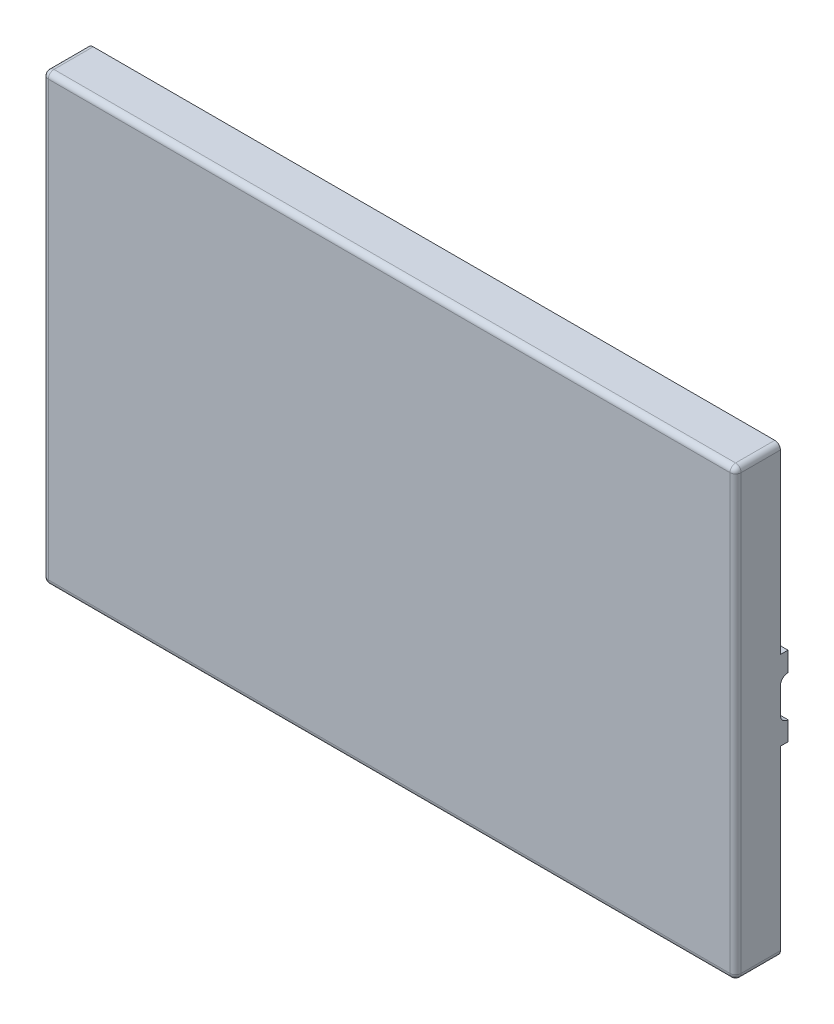
from build123d import *

# Parameters (mm, degrees)
SKETCH1_W                                = 157.01375
SKETCH1_H                                = 100.80625
BOSS_EXTRUDE1_DEPTH                      = 10.16
SKETCH2_W                                = 144.31375
SKETCH2_H                                = 88.10625
CUT_EXTRUDE1_DEPTH                       = 3.81
SKETCH3_R                                = 1.373000048
BOSS_EXTRUDE2_DEPTH                      = 13.208
SKETCH4_R                                = 1.905
SKETCH4_W                                = 38.820000042
SKETCH4_H                                = 30.86
BOSS_EXTRUDE3_DEPTH                      = 3.556
SKETCH5_W                                = 140.45073311
SKETCH5_H                                = 20.997286457
CUT_EXTRUDE2_DEPTH                       = 61.722
SKETCH6_W                                = 3.175
SKETCH6_H                                = 3.175
BOSS_EXTRUDE4_DEPTH                      = 6.985
SKETCH7_W                                = 1.5875
SKETCH7_H                                = 1.5875
CUT_EXTRUDE3_DEPTH                       = 6.985
MIRROR2_COPY_1_SKETCH_W                  = 3.175
MIRROR2_COPY_1_SKETCH_H                  = 3.175
MIRROR2_COPY_1_DEPTH                     = 6.985
MIRROR2_COPY_2_SKETCH_W                  = 1.5875
MIRROR2_COPY_2_SKETCH_H                  = 1.5875
MIRROR2_COPY_2_DEPTH                     = 6.985
CUT_EXTRUDE4_DEPTH                       = 3.175
MIRROR3_AT_THE_SECOND_PLANE_COPY_1_DEPTH = 3.175
FILLET1_R                                = 1.27
SKETCH9_W                                = 23.8125
SKETCH9_H                                = 15.875
BOSS_EXTRUDE5_DEPTH                      = 11.4935
CUT_EXTRUDE5_START                       = -1.5875
SKETCH10_W                               = 9.261227228
SKETCH10_H                               = 18.25625
CUT_EXTRUDE5_DEPTH                       = 13.97
SKETCH12_W                               = 17.78
SKETCH12_H                               = 18.25625
BOSS_EXTRUDE6_DEPTH                      = 3.01625
SKETCH13_W                               = 3.175
SKETCH13_H                               = 8.09625
BOSS_EXTRUDE7_DEPTH                      = 5.08
BOSS_EXTRUDE9_DEPTH                      = 1.5875
SKETCH17_W                               = 25.4
SKETCH17_H                               = 3.81
SKETCH17_W_2                             = 3.81
SKETCH17_H_2                             = 6.35
BOSS_EXTRUDE10_DEPTH                     = 5.36575
SKETCH18_W                               = 19.05
SKETCH18_H                               = 17.414875
SKETCH18_W_2                             = 6.35
BOSS_EXTRUDE11_DEPTH                     = 3.556
SKETCH19_W                               = 13.81125
SKETCH19_H                               = 4.34975
BOSS_EXTRUDE12_DEPTH                     = 6.35
SKETCH21_W                               = 5.794375
SKETCH21_H                               = 6.35
BOSS_EXTRUDE13_DEPTH                     = 10.4775
SKETCH22_W                               = 19.84375
SKETCH22_H                               = 0.79375
CUT_EXTRUDE6_DEPTH                       = 6.12775
SKETCH23_W                               = 1.905
SKETCH23_H                               = 6.35
SKETCH23_W_2                             = 25.4
SKETCH23_H_2                             = 1.905
CUT_EXTRUDE7_DEPTH                       = 5.36575


with BuildPart() as part:
    # Sketch1 → Boss-Extrude1 (new body)
    with BuildSketch(Plane.XY):
        with Locations((-142.135983, -138.289483)):
            Rectangle(SKETCH1_W, SKETCH1_H)
    extrude(amount=BOSS_EXTRUDE1_DEPTH)

    # Sketch2 → Cut-Extrude1 (cut)
    with BuildSketch(Plane(origin=(0, 0, 0), x_dir=(-1, 0, 0), z_dir=(0, 0, -1))):
        with Locations((142.135983, -138.289483)):
            Rectangle(SKETCH2_W, SKETCH2_H)
    extrude(amount=-CUT_EXTRUDE1_DEPTH, mode=Mode.SUBTRACT)

    # Sketch3 → Boss-Extrude2 (add)
    with BuildSketch(Plane(origin=(0, 0, 3.81), x_dir=(-1, 0, 0), z_dir=(0, 0, -1))):
        with Locations((109.299108, -111.990108)):
            Circle(SKETCH3_R)
        with Locations((156.249108, -111.990108)):
            Circle(SKETCH3_R)
        with Locations((156.249108, -136.500108)):
            Circle(SKETCH3_R)
        with Locations((109.299108, -136.500108)):
            Circle(SKETCH3_R)
    extrude(amount=BOSS_EXTRUDE2_DEPTH)

    # Sketch4 → Boss-Extrude3 (add)
    # profile 1 of 3: a face of its own
    with BuildSketch(Plane(origin=(0, 0, 3.81), x_dir=(-1, 0, 0), z_dir=(0, 0, -1))):
        with Locations(Location((109.299108, -111.990108, 0), (0, 0, 180))):
            Circle(SKETCH4_R)
    # profile 2 of 3: a face of its own
    with BuildSketch(Plane(origin=(0, 0, 3.81), x_dir=(-1, 0, 0), z_dir=(0, 0, -1))):
        with Locations(Location((109.299108, -136.500108, 0), (0, 0, 180))):
            Circle(SKETCH4_R)
    # profile 3 of 3: a face of its own
    with BuildSketch(Plane(origin=(0, 0, 3.81), x_dir=(-1, 0, 0), z_dir=(0, 0, -1))):
        Polygon((112.454108, -105.170108), (191.274108, -105.170108), (191.274108, -110.270108), (201.354108, -110.270108), (201.354108, -143.270108), (112.454108, -143.270108), align=None)
        with Locations((135.039108021, -124.245108)):
            Rectangle(SKETCH4_W, SKETCH4_H, mode=Mode.SUBTRACT)
    extrude(amount=BOSS_EXTRUDE3_DEPTH)

    # Sketch5 → Cut-Extrude2 (cut)
    with BuildSketch(Plane(origin=(0, -87.886358, 0), x_dir=(1, 0, 0), z_dir=(0, 1, 0))):
        with Locations((-140.972363451, 12.879893229)):
            Rectangle(SKETCH5_W, SKETCH5_H)
    extrude(amount=-CUT_EXTRUDE2_DEPTH, mode=Mode.SUBTRACT)

    # Sketch6 → Boss-Extrude4 (add)
    with BuildSketch(Plane(origin=(0, 0, 3.81), x_dir=(-1, 0, 0), z_dir=(0, 0, -1))):
        with Locations((71.566608, -180.755108)):
            Rectangle(SKETCH6_W, SKETCH6_H)
    boss_extrude4 = extrude(amount=BOSS_EXTRUDE4_DEPTH)

    # Sketch7 → Cut-Extrude3 (cut)
    with BuildSketch(Plane(origin=(0, 0, -3.175), x_dir=(-1, 0, 0), z_dir=(0, 0, -1))):
        with Locations((72.360358, -179.961358)):
            Rectangle(SKETCH7_W, SKETCH7_H)
    cut_extrude3 = extrude(amount=-CUT_EXTRUDE3_DEPTH, mode=Mode.SUBTRACT)

    # Mirror1: Boss-Extrude4, Cut-Extrude3 across plane
    add(boss_extrude4.mirror(Plane(origin=(0, -138.289483, 0), x_dir=(0, 0, 1), z_dir=(0, -1, 0))))
    add(cut_extrude3.mirror(Plane(origin=(0, -138.289483, 0), x_dir=(0, 0, 1), z_dir=(0, -1, 0))), mode=Mode.SUBTRACT)

    # Mirror2: Boss-Extrude4, Cut-Extrude3 across plane
    add(boss_extrude4.mirror(Plane(origin=(-142.135983, 0, 0), x_dir=(0, 0, 1), z_dir=(1, 0, 0))))
    add(cut_extrude3.mirror(Plane(origin=(-142.135983, 0, 0), x_dir=(0, 0, 1), z_dir=(1, 0, 0))), mode=Mode.SUBTRACT)

    # Mirror2 copy 1 sketch → Mirror2 copy 1 (add)
    with BuildSketch(Plane(origin=(-284.271966, -276.578966, 3.81), x_dir=(1, 0, 0), z_dir=(0, 0, -1))):
        with Locations((71.566608, -180.755108)):
            Rectangle(MIRROR2_COPY_1_SKETCH_W, MIRROR2_COPY_1_SKETCH_H)
    extrude(amount=MIRROR2_COPY_1_DEPTH)

    # Mirror2 copy 2 sketch → Mirror2 copy 2 (cut)
    with BuildSketch(Plane(origin=(-284.271966, -276.578966, -3.175), x_dir=(1, 0, 0), z_dir=(0, 0, -1))):
        with Locations((72.360358, -179.961358)):
            Rectangle(MIRROR2_COPY_2_SKETCH_W, MIRROR2_COPY_2_SKETCH_H)
    extrude(amount=-MIRROR2_COPY_2_DEPTH, mode=Mode.SUBTRACT)

    # Sketch8 → Cut-Extrude4 (cut)
    with BuildSketch(Plane(origin=(0, 0, -3.175), x_dir=(-1, 0, 0), z_dir=(0, 0, -1))):
        Polygon((69.979108, -179.167608), (70.1775455, -179.167608), (70.1775455, -182.1441705), (73.154108, -182.1441705), (73.154108, -182.342608), (69.979108, -182.342608), align=None)
    cut_extrude4 = extrude(amount=-CUT_EXTRUDE4_DEPTH, mode=Mode.SUBTRACT)

    # Mirror3: Cut-Extrude4 across plane
    add(cut_extrude4.mirror(Plane(origin=(-142.135983, 0, 0), x_dir=(0, 0, 1), z_dir=(1, 0, 0))), mode=Mode.SUBTRACT)

    # Mirror3 at the second plane: Cut-Extrude4 across plane
    add(cut_extrude4.mirror(Plane(origin=(0, -138.289483, 0), x_dir=(0, 0, 1), z_dir=(0, -1, 0))), mode=Mode.SUBTRACT)

    # Mirror3 at the second plane copy 1 sketc → Mirror3 at the second plane copy 1 (cut)
    with BuildSketch(Plane(origin=(-284.271966, -276.578966, -3.175), x_dir=(1, 0, 0), z_dir=(0, 0, -1))):
        Polygon((69.979108, -179.167608), (70.1775455, -179.167608), (70.1775455, -182.1441705), (73.154108, -182.1441705), (73.154108, -182.342608), (69.979108, -182.342608), align=None)
    extrude(amount=-MIRROR3_AT_THE_SECOND_PLANE_COPY_1_DEPTH, mode=Mode.SUBTRACT)

    # Fillet1
    fillet1_edges = [part.edges().sort_by_distance(p)[0] for p in [
        (-220.642858, -138.289483, 10.16),
        (-142.135983, -188.692608, 10.16),
        (-63.629108, -138.289483, 10.16),
        (-63.629108, -188.692608, 5.08),
        (-220.642858, -188.692608, 5.08),
        (-220.642858, -87.886358, 5.08),
        (-63.629108, -87.886358, 5.08),
        (-142.135983, -87.886358, 10.16),
    ]]
    fillet(fillet1_edges, radius=FILLET1_R)

    # Sketch9 → Boss-Extrude5 (add)
    with BuildSketch(Plane(origin=(0, 0, 3.81), x_dir=(-1, 0, 0), z_dir=(0, 0, -1))):
        with Locations((192.464733, -166.070733)):
            Rectangle(SKETCH9_W, SKETCH9_H)
    extrude(amount=BOSS_EXTRUDE5_DEPTH)

    # Sketch10 → Cut-Extrude5 (cut)
    with BuildSketch(Plane(origin=(-63.629108, 0, 0), x_dir=(0, 0, -1), z_dir=(1, 0, 0)).offset(CUT_EXTRUDE5_START)):
        with Locations((3.836863614, -138.289483)):
            Rectangle(SKETCH10_W, SKETCH10_H)
    extrude(amount=-CUT_EXTRUDE5_DEPTH, mode=Mode.SUBTRACT)

    # Sketch12 → Boss-Extrude6 (add)
    with BuildSketch(Plane(origin=(0, 0, 3.81), x_dir=(-1, 0, 0), z_dir=(0, 0, -1))):
        with Locations((78.869108, -138.289483)):
            Rectangle(SKETCH12_W, SKETCH12_H)
    extrude(amount=BOSS_EXTRUDE6_DEPTH)

    # Sketch13 → Boss-Extrude7 (add)
    with BuildSketch(Plane(origin=(0, 0, 3.81), x_dir=(-1, 0, 0), z_dir=(0, 0, -1))):
        with Locations((93.262857978, -138.289483)):
            Rectangle(SKETCH13_W, SKETCH13_H)
    extrude(amount=BOSS_EXTRUDE7_DEPTH)

    # Sketch14 → Boss-Extrude9 (add)
    with BuildSketch(Plane(origin=(-63.629108, 0, 0), x_dir=(0, 0, -1), z_dir=(1, 0, 0))):
        with BuildLine():
            Line((0, -129.288357934), (0, -135.446608))
            ThreePointArc((0, -135.446608), (0.502861016, -134.232594116), (1.7168749, -133.7297331))
            Line((1.7168749, -133.7297331), (1.7168749, -129.288357934))
            Line((1.7168749, -129.288357934), (0, -129.288357934))
        make_face()
        with BuildLine():
            Line((0, -147.290608064), (1.7168749, -147.290608064))
            Line((1.7168749, -147.290608064), (1.7168749, -142.9434829))
            ThreePointArc((1.7168749, -142.9434829), (0.502861016, -142.440621884), (0, -141.226608))
            Line((0, -141.226608), (0, -147.290608064))
        make_face()
    extrude(amount=-BOSS_EXTRUDE9_DEPTH)

    # Sketch17 → Boss-Extrude10 (add)
    with BuildSketch(Plane(origin=(0, 0, 3.81), x_dir=(-1, 0, 0), z_dir=(0, 0, -1))):
        with Locations((155.158483, -172.103233)):
            Rectangle(SKETCH17_W, SKETCH17_H)
        with Locations((155.158483, -150.878358)):
            Rectangle(SKETCH17_W, SKETCH17_H)
        with Locations((175.6769205, -161.4907955)):
            Rectangle(SKETCH17_W_2, SKETCH17_H_2)
        with Locations((134.6400455, -161.4907955)):
            Rectangle(SKETCH17_W_2, SKETCH17_H_2)
    extrude(amount=BOSS_EXTRUDE10_DEPTH)

    # Sketch18 → Boss-Extrude11 (add)
    with BuildSketch(Plane(origin=(0, 0, 3.81), x_dir=(-1, 0, 0), z_dir=(0, 0, -1))):
        with Locations((146.0700455, -161.4907955)):
            Rectangle(SKETCH18_W, SKETCH18_H)
        with Locations((170.5969205, -161.4907955)):
            Rectangle(SKETCH18_W_2, SKETCH18_H)
    extrude(amount=BOSS_EXTRUDE11_DEPTH)

    # Sketch19 → Boss-Extrude12 (add)
    with BuildSketch(Plane.XZ.offset(188.692608)):
        with Locations((-157.943647906, -2.174875)):
            Rectangle(SKETCH19_W, SKETCH19_H)
    extrude(amount=-BOSS_EXTRUDE12_DEPTH)

    # Sketch21 → Boss-Extrude13 (add)
    with BuildSketch(Plane(origin=(0, 0, 0), x_dir=(-1, 0, 0), z_dir=(0, 0, -1))):
        with Locations((148.140835406, -185.517608)):
            Rectangle(SKETCH21_W, SKETCH21_H)
        with Locations((167.746460406, -185.517608)):
            Rectangle(SKETCH21_W, SKETCH21_H)
    extrude(amount=BOSS_EXTRUDE13_DEPTH)

    # Sketch22 → Cut-Extrude6 (cut)
    with BuildSketch(Plane(origin=(0, 0, -10.4775), x_dir=(-1, 0, 0), z_dir=(0, 0, -1))):
        with Locations((157.943647906, -185.517608)):
            Rectangle(SKETCH22_W, SKETCH22_H)
    extrude(amount=-CUT_EXTRUDE6_DEPTH, mode=Mode.SUBTRACT)

    # Sketch23 → Cut-Extrude7 (cut)
    with BuildSketch(Plane(origin=(0, 0, -1.55575), x_dir=(-1, 0, 0), z_dir=(0, 0, -1))):
        with Locations((133.6875455, -161.4907955)):
            Rectangle(SKETCH23_W, SKETCH23_H)
        with Locations((155.158483, -173.055733)):
            Rectangle(SKETCH23_W_2, SKETCH23_H_2)
        with Locations((176.6294205, -161.4907955)):
            Rectangle(SKETCH23_W, SKETCH23_H)
        with Locations((155.158483, -149.925858)):
            Rectangle(SKETCH23_W_2, SKETCH23_H_2)
    extrude(amount=-CUT_EXTRUDE7_DEPTH, mode=Mode.SUBTRACT)


solid = part.part
